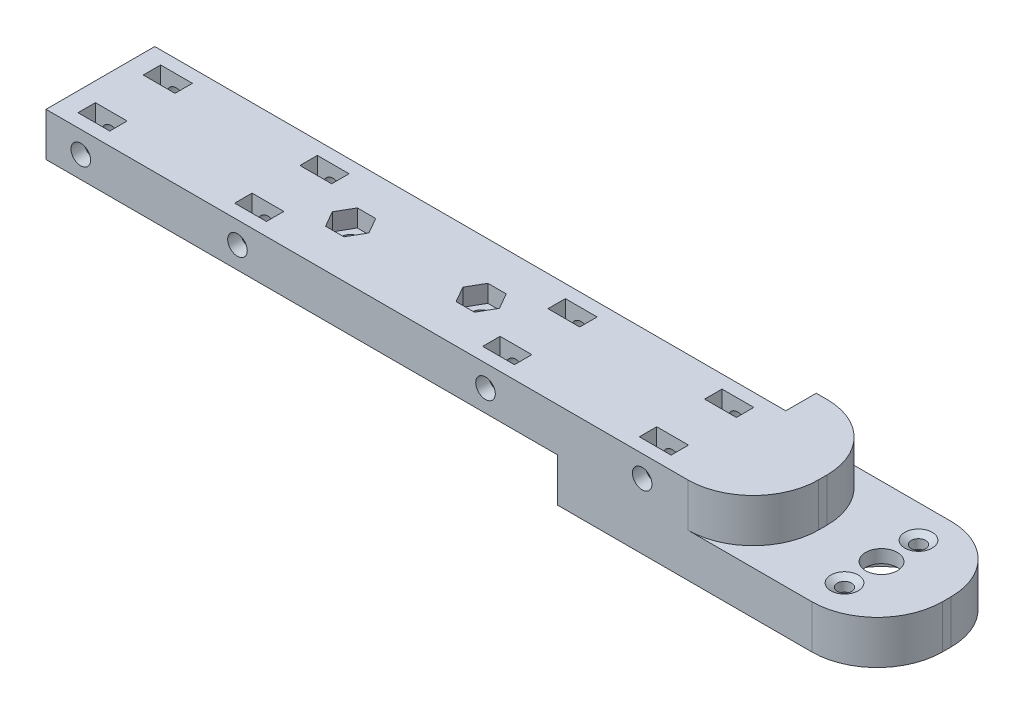
from build123d import *

# Parameters (mm, degrees)
SKETCH1_W           = 145
SKETCH1_H           = 25
BOSS_EXTRUDE1_DEPTH = 10
SKETCH2_W           = 17.5
SKETCH2_H           = 32
BOSS_EXTRUDE2_DEPTH = 10
SKETCH4_W           = 73.5
SKETCH4_H           = 32
BOSS_EXTRUDE3_DEPTH = 10
SKETCH8_R           = 2.25
CUT_EXTRUDE5_DEPTH  = 193.888568868
SKETCH9_W           = 7.3
SKETCH9_H           = 4
CUT_EXTRUDE6_DEPTH  = 10
CUT_EXTRUDE7_REACH  = 195.92
SKETCH10_R          = 3.65
SKETCH11_R          = 12.75
CUT_EXTRUDE8_DEPTH  = 7
CUT_EXTRUDE11_REACH = 196.098
SKETCH14_R          = 1.65
CHAMFER1_SIZE       = 1.5
CHAMFER1_SIZE2      = 0.866025404
FILLET1_R           = 15
SKETCH15_R          = 2.25
CUT_EXTRUDE12_DEPTH = 195.692064553
CUT_EXTRUDE13_DEPTH = 4


with BuildPart() as part:
    # Sketch1 → Boss-Extrude1 (new body)
    with BuildSketch(Plane(origin=(0, 0, 0), x_dir=(1, 0, 0), z_dir=(0, 1, 0))):
        with Locations((72.5, 12.5)):
            Rectangle(SKETCH1_W, SKETCH1_H)
    extrude(amount=BOSS_EXTRUDE1_DEPTH)

    # Sketch2 → Boss-Extrude2 (add)
    with BuildSketch(Plane(origin=(0, 10, 0), x_dir=(1, 0, 0), z_dir=(0, 1, 0))):
        with Locations((153.75, 16)):
            Rectangle(SKETCH2_W, SKETCH2_H)
    extrude(amount=-BOSS_EXTRUDE2_DEPTH)

    # Sketch4 → Boss-Extrude3 (add)
    with BuildSketch(Plane.XZ):
        with Locations((154.25, -16)):
            Rectangle(SKETCH4_W, SKETCH4_H)
    extrude(amount=BOSS_EXTRUDE3_DEPTH)

    # Sketch8 → Cut-Extrude5 (cut, through all)
    with BuildSketch(Plane(origin=(0, 0, -25), x_dir=(-1, 0, 0), z_dir=(0, 0, -1))):
        with Locations((-137, 5)):
            Circle(SKETCH8_R)
        with Locations((-101, 5)):
            Circle(SKETCH8_R)
        with Locations(Location((-44, 5, 0), (0, 0, 180))):
            Circle(SKETCH8_R)
        with Locations(Location((-8, 5, 0), (0, 0, 180))):
            Circle(SKETCH8_R)
    extrude(amount=-CUT_EXTRUDE5_DEPTH, mode=Mode.SUBTRACT)

    # Sketch9 → Cut-Extrude6 (cut)
    with BuildSketch(Plane(origin=(0, 10, 0), x_dir=(1, 0, 0), z_dir=(0, 1, 0))):
        with Locations((137, 20)):
            Rectangle(SKETCH9_W, SKETCH9_H)
        with Locations((137, 5)):
            Rectangle(SKETCH9_W, SKETCH9_H)
        with Locations((101, 5)):
            Rectangle(SKETCH9_W, SKETCH9_H)
        with Locations((101, 20)):
            Rectangle(SKETCH9_W, SKETCH9_H)
        with Locations((8, 20)):
            Rectangle(SKETCH9_W, SKETCH9_H)
        with Locations((44, 20)):
            Rectangle(SKETCH9_W, SKETCH9_H)
        with Locations((44, 5)):
            Rectangle(SKETCH9_W, SKETCH9_H)
        with Locations((8, 5)):
            Rectangle(SKETCH9_W, SKETCH9_H)
    extrude(amount=-CUT_EXTRUDE6_DEPTH, mode=Mode.SUBTRACT)

    # Sketch10 → Cut-Extrude7 (cut, up to next)
    with BuildSketch(Plane(origin=(0, 0, 0), x_dir=(1, 0, 0), z_dir=(0, 1, 0)), mode=Mode.PRIVATE) as cut_extrude7_sk1:
        with Locations(Location((176, 16, 0), (0, 0, 270))):
            Circle(SKETCH10_R)
    cut_extrude7_tool1 = extrude(cut_extrude7_sk1.sketch, amount=-CUT_EXTRUDE7_REACH, mode=Mode.PRIVATE) & part.part
    add(cut_extrude7_tool1.solids().sort_by_distance((176, 0, -16))[0], mode=Mode.SUBTRACT)

    # Sketch11 → Cut-Extrude8 (cut)
    with BuildSketch(Plane.XZ.offset(10)):
        with Locations(Location((176, -16, 0), (0, 0, 270))):
            Circle(SKETCH11_R)
    extrude(amount=-CUT_EXTRUDE8_DEPTH, mode=Mode.SUBTRACT)

    # Sketch14 → Cut-Extrude11 (cut, up to next)
    with BuildSketch(Plane.XZ.offset(3), mode=Mode.PRIVATE) as cut_extrude11_sk1:
        with Locations(Location((176, -7.5, 0), (0, 0, 270))):
            Circle(SKETCH14_R)
    cut_extrude11_tool1 = extrude(cut_extrude11_sk1.sketch, amount=-CUT_EXTRUDE11_REACH, mode=Mode.PRIVATE) & part.part
    # Sketch14 → Cut-Extrude11 (cut, up to next)
    with BuildSketch(Plane.XZ.offset(3), mode=Mode.PRIVATE) as cut_extrude11_sk2:
        with Locations(Location((176, -24.5, 0), (0, 0, 270))):
            Circle(SKETCH14_R)
    cut_extrude11_tool2 = extrude(cut_extrude11_sk2.sketch, amount=-CUT_EXTRUDE11_REACH, mode=Mode.PRIVATE) & part.part
    add(cut_extrude11_tool1.solids().sort_by_distance((176, -3, -7.5))[0], mode=Mode.SUBTRACT)
    add(cut_extrude11_tool2.solids().sort_by_distance((176, -3, -24.5))[0], mode=Mode.SUBTRACT)

    # Chamfer1
    chamfer1_edges = [part.edges().sort_by_distance(p)[0] for p in [
        (176, 0, -5.85),
        (176, 0, -22.85),
    ]]
    chamfer1_side = [part.faces().sort_by_distance(p)[0] for p in [
        (162.928514877, 0, -16),
    ]]
    chamfer(chamfer1_edges, length=CHAMFER1_SIZE, length2=CHAMFER1_SIZE2, reference=chamfer1_side[0])

    # Fillet1
    fillet1_edges = [part.edges().sort_by_distance(p)[0] for p in [
        (162.5, 5, -32),
        (162.5, 5, 0),
        (191, -5, -32),
        (191, -5, 0),
    ]]
    fillet(fillet1_edges, radius=FILLET1_R)

    # Sketch15 → Cut-Extrude12 (cut, through all)
    with BuildSketch(Plane(origin=(0, 10, 0), x_dir=(1, 0, 0), z_dir=(0, 1, 0))):
        with Locations(Location((57.5, 12.5, 0), (0, 0, 270))):
            Circle(SKETCH15_R)
        with Locations(Location((87.5, 12.5, 0), (0, 0, 270))):
            Circle(SKETCH15_R)
    extrude(amount=-CUT_EXTRUDE12_DEPTH, mode=Mode.SUBTRACT)

    # Sketch16 → Cut-Extrude13 (cut)
    with BuildSketch(Plane(origin=(0, 10, 0), x_dir=(1, 0, 0), z_dir=(0, 1, 0))):
        Polygon((91.714656965, 12.5), (89.607328483, 16.15), (85.392671517, 16.15), (83.285343035, 12.5), (85.392671517, 8.85), (89.607328483, 8.85), align=None)
        Polygon((61.714656965, 12.5), (59.607328483, 16.15), (55.392671517, 16.15), (53.285343035, 12.5), (55.392671517, 8.85), (59.607328483, 8.85), align=None)
    extrude(amount=-CUT_EXTRUDE13_DEPTH, mode=Mode.SUBTRACT)


solid = part.part
